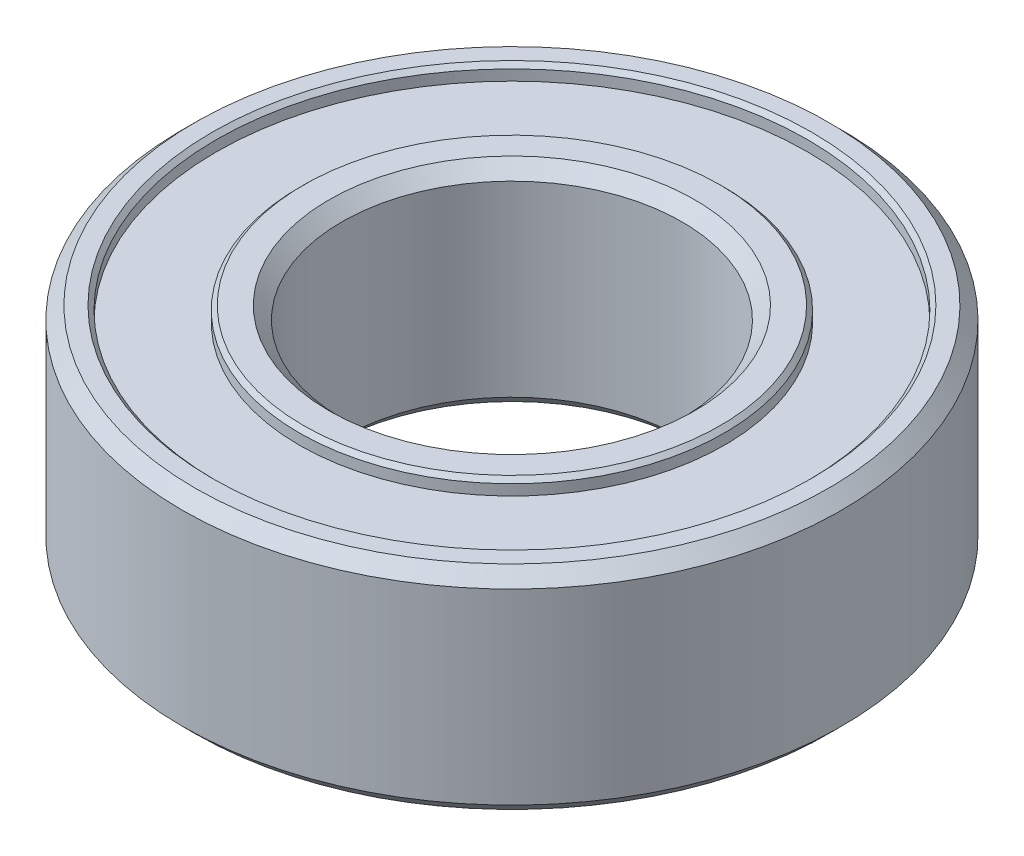
from build123d import *

# Parameters (mm, degrees)
SKETCH1_R             = 15.5
SKETCH1_R_2           = 13.9
BOSS_EXTRUDE1_DEPTH   = 10
SKETCH1_R_3           = 10
SKETCH1_R_4           = 8
BOSS_EXTRUDE1_2_DEPTH = 10
BOSS_EXTRUDE2_START   = -4.3
SKETCH2_R             = 13.9
SKETCH2_R_2           = 10
BOSS_EXTRUDE2_DEPTH   = 8.6
CHAMFER1_SIZE         = 0.6
CHAMFER2_SIZE         = 0.2


with BuildPart() as part:
    # Sketch1 → Boss-Extrude1 (new body)
    with BuildSketch(Plane(origin=(0, 0, 0), x_dir=(1, 0, 0), z_dir=(0, 1, 0))):
        with Locations(Location((0, 0, 0), (0, 0, 270))):
            Circle(SKETCH1_R)
        with Locations(Location((0, 0, 0), (0, 0, 270))):
            Circle(SKETCH1_R_2, mode=Mode.SUBTRACT)
    extrude(amount=BOSS_EXTRUDE1_DEPTH)



with BuildPart() as body_2:
    # Sketch1 → Boss-Extrude1 2 (new body)
    with BuildSketch(Plane(origin=(0, 0, 0), x_dir=(1, 0, 0), z_dir=(0, 1, 0))):
        with Locations(Location((0, 0, 0), (0, 0, 270))):
            Circle(SKETCH1_R_3)
        with Locations(Location((0, 0, 0), (0, 0, 270))):
            Circle(SKETCH1_R_4, mode=Mode.SUBTRACT)
    extrude(amount=BOSS_EXTRUDE1_2_DEPTH)


with BuildPart() as part_1:
    add(part.part)

    add(body_2.part)  # Boss-Extrude2 merges body 2
    # Sketch2 → Boss-Extrude2 (add)
    with BuildSketch(Plane(origin=(0, 5, 0), x_dir=(1, 0, 0), z_dir=(0, 1, 0)).offset(BOSS_EXTRUDE2_START)):
        with Locations(Location((0, 0, 0), (0, 0, 270))):
            Circle(SKETCH2_R)
        with Locations(Location((0, 0, 0), (0, 0, 270))):
            Circle(SKETCH2_R_2, mode=Mode.SUBTRACT)
    extrude(amount=BOSS_EXTRUDE2_DEPTH)

    # Chamfer1
    chamfer1_edges = [part_1.edges().sort_by_distance(p)[0] for p in [
        (0, 10, -15.5),
        (0, 10, -8),
        (0, 0, -8),
        (0, 0, -15.5),
    ]]
    chamfer(chamfer1_edges, length=CHAMFER1_SIZE)

    # Chamfer2
    chamfer2_edges = [part_1.edges().sort_by_distance(p)[0] for p in [
        (0, 0, -10),
        (0, 10, -10),
        (0, 0, -13.9),
        (0, 10, -13.9),
    ]]
    chamfer(chamfer2_edges, length=CHAMFER2_SIZE)


solid = part_1.part
